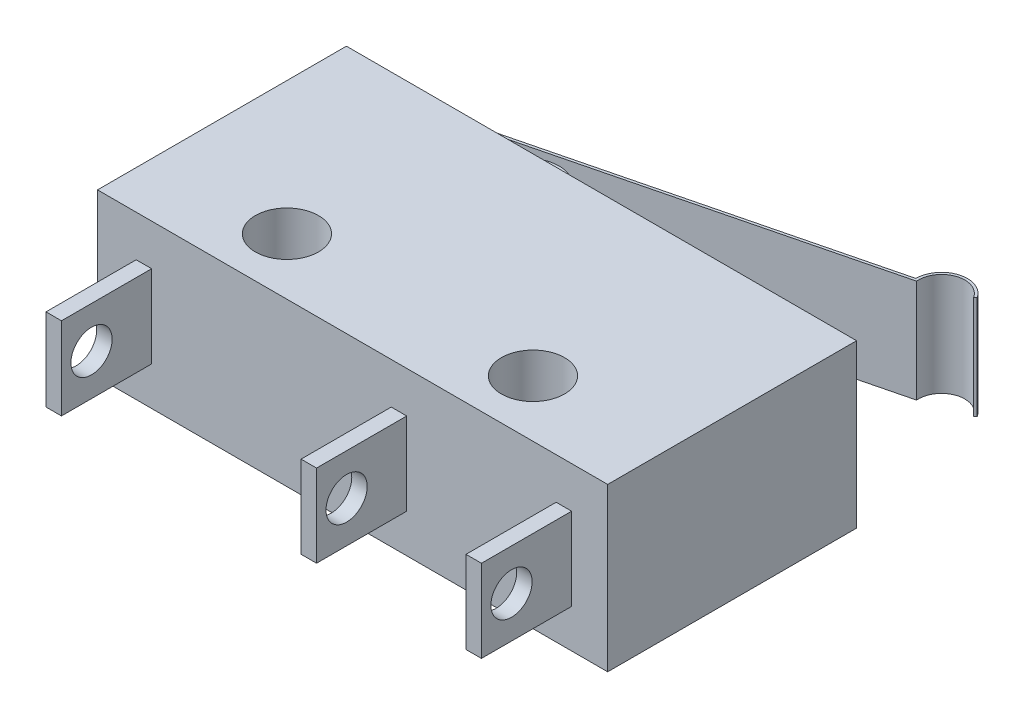
from build123d import *

# Parameters (mm, degrees)
SKETCH1_W           = 19.8
SKETCH1_H           = 9.66
MAINBODY_DEPTH      = 6.3
SKETCH2_R           = 1.225
MOUNTINGHOLES_DEPTH = 13.689716309
SKETCH3_W           = 0.6
SKETCH3_H           = 3.2
BOSS_EXTRUDE2_DEPTH = 3.5
SKETCH4_R           = 0.8
CUT_EXTRUDE2_DEPTH  = 22.157478583
SKETCH5_R           = 1.25
BUMPSWITCH_DEPTH    = 2
EXTRUDE_THIN1_DEPTH = 2


with BuildPart() as part:
    # Sketch1 → MainBody (new body)
    with BuildSketch(Plane(origin=(0, 0, 0), x_dir=(1, 0, 0), z_dir=(0, 1, 0))):
        Rectangle(SKETCH1_W, SKETCH1_H)
    extrude(amount=MAINBODY_DEPTH)

    # Sketch2 → MountingHoles (cut, through all)
    with BuildSketch(Plane(origin=(0, 6.3, 0), x_dir=(1, 0, 0), z_dir=(0, 1, 0))):
        with Locations(Location((-4.75, -2.63, 0), (0, 0, 270))):
            Circle(SKETCH2_R)
        with Locations(Location((4.8, -2.63, 0), (0, 0, 270))):
            Circle(SKETCH2_R)
    extrude(amount=-MOUNTINGHOLES_DEPTH, mode=Mode.SUBTRACT)

    # Sketch3 → Boss-Extrude2 (add)
    with BuildSketch(Plane.XY.offset(4.83)):
        with Locations((-8.1, 3.1)):
            Rectangle(SKETCH3_W, SKETCH3_H)
        with Locations((1.8, 3.1)):
            Rectangle(SKETCH3_W, SKETCH3_H)
        with Locations((8.2, 3.1)):
            Rectangle(SKETCH3_W, SKETCH3_H)
    extrude(amount=BOSS_EXTRUDE2_DEPTH)

    # Sketch4 → Cut-Extrude2 (cut, through all)
    with BuildSketch(Plane(origin=(8.5, 0, 0), x_dir=(0, 0, -1), z_dir=(1, 0, 0))):
        with Locations((-7.162962761, 3.1)):
            Circle(SKETCH4_R)
    extrude(amount=-CUT_EXTRUDE2_DEPTH, mode=Mode.SUBTRACT)

    # Sketch5 → BumpSwitch (add, symmetric)
    with BuildSketch(Plane(origin=(0, 3.15, 0), x_dir=(1, 0, 0), z_dir=(0, 1, 0))):
        with Locations((-2.9, 4.83)):
            Circle(SKETCH5_R)
    extrude(amount=BUMPSWITCH_DEPTH, both=True)

    # Sketch6 → Extrude-Thin1 (add, symmetric)
    with BuildSketch(Plane(origin=(0, 3.15, 0), x_dir=(1, 0, 0), z_dir=(0, 1, 0))):
        with BuildLine():
            Line((-7.9, 4.222056191), (-7.9, 4.83))
            ThreePointArc((-7.9, 4.83), (-7.753756221, 5.211453805), (-7.408601461, 5.43))
            Line((-7.408601461, 5.43), (7.80720966, 9.223727798))
            ThreePointArc((7.80720966, 9.223727798), (8.52542957, 10.181011183), (9.647220295, 9.764097659))
            Line((9.647220295, 9.764097659), (9.56321899, 9.709841039))
            ThreePointArc((9.56321899, 9.709841039), (8.516809587, 10.073393654), (7.910350182, 9.146382256))
            Line((7.910350182, 9.146382256), (-7.384409271, 5.332970427))
            ThreePointArc((-7.384409271, 5.332970427), (-7.675692454, 5.148943939), (-7.8, 4.827604127))
            Line((-7.8, 4.827604127), (-7.8, 4.222056191))
            Line((-7.8, 4.222056191), (-7.9, 4.222056191))
        make_face()
    extrude(amount=EXTRUDE_THIN1_DEPTH, both=True)


solid = part.part
